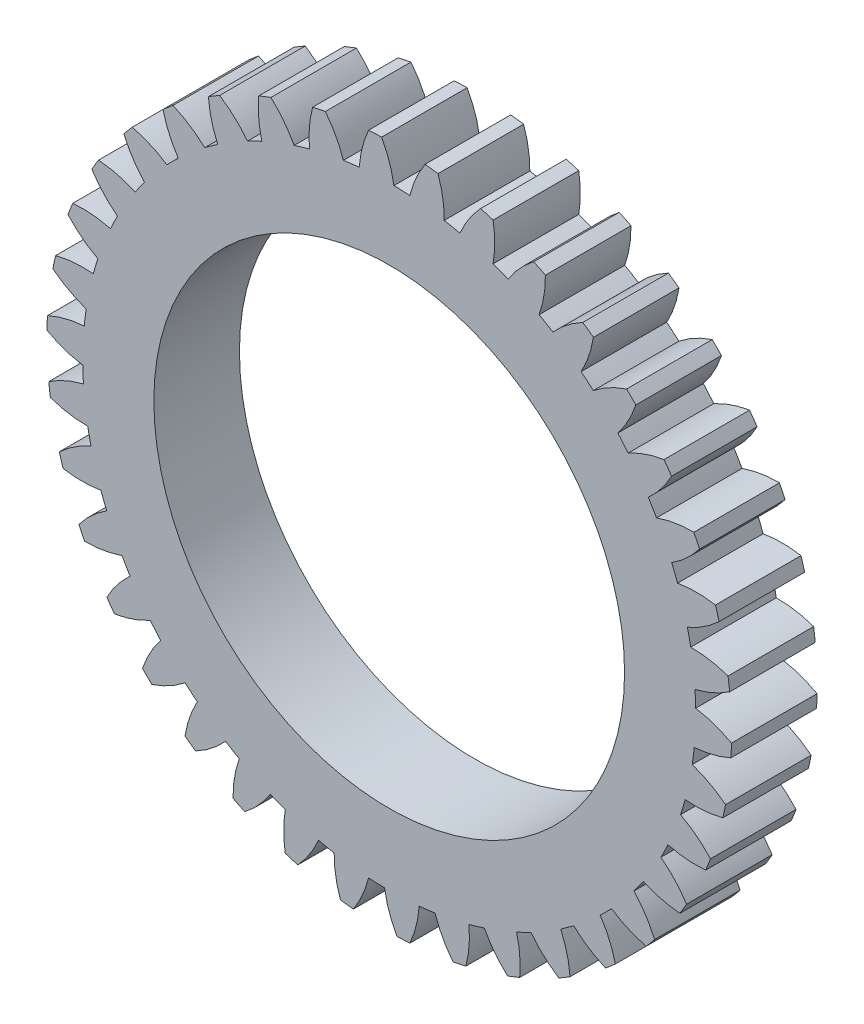
from build123d import *

# Parameters (mm, degrees)
BODY_DEPTH         = 10
TOOTHEXTRUDE_DEPTH = 10
CIRPATTERN1_COUNT  = 38
SKETCH5_R          = 27.5
CUT_EXTRUDE1_DEPTH = 58.431802193


with BuildPart() as part:
    # Gear → body (new body)
    with BuildSketch(Plane.XY):
        with BuildLine():
            ThreePointArc((-3.501112539, 35.635289159), (-24.049612849, -26.528244274), (35.806865577, 0))
            ThreePointArc((35.806865577, 0), (25.511733112, 25.125347681), (0.54641561, 35.802696162))
            ThreePointArc((0.54641561, 35.802696162), (-1.479717798, 35.776277863), (-3.501112539, 35.635289159))
        make_face()
    extrude(amount=BODY_DEPTH)

    # Gear<3> → ToothExtrude (add)
    with BuildSketch(Plane.XY):
        with BuildLine():
            ThreePointArc((-3.501112539, 35.635289159), (-1.479717798, 35.776277863), (0.54641561, 35.802696162))
            add(Edge.make_bspline(
                [(0.54641561, 35.802696162), (0.533338051, 35.886308917), (0.28734018, 37.365137899), (-0.205755547, 38.755971582), (-0.891099015, 39.99007305)],
                knots=[-0.056473224, -0.056473224, -0.056473224, -0.056473224, 0, 0.945697652, 0.945697652, 0.945697652, 0.945697652], degree=3))
            ThreePointArc((-0.891099015, 39.99007305), (-1.65299897, 39.965830335), (-2.414298597, 39.927073049))
            add(Edge.make_bspline(
                [(-3.501112539, 35.635289159), (-3.494984333, 35.719696271), (-3.371947399, 37.213788645), (-2.995389979, 38.640591448), (-2.414298597, 39.927073049)],
                knots=[-0.056473224, -0.056473224, -0.056473224, -0.056473224, 0, 0.945697652, 0.945697652, 0.945697652, 0.945697652], degree=3))
        make_face()
    toothextrude = extrude(amount=TOOTHEXTRUDE_DEPTH)

    # CirPattern1: ToothExtrude ×38 about axis
    cirpattern1_axis = Axis((0, 0, 10), (0, 0, -1))
    for i in range(1, CIRPATTERN1_COUNT):
        add(toothextrude.rotate(cirpattern1_axis, i * 360 / CIRPATTERN1_COUNT))

    # Sketch5 → Cut-Extrude1 (cut, through all)
    with BuildSketch(Plane.XY.offset(10)):
        Circle(SKETCH5_R)
    extrude(amount=-CUT_EXTRUDE1_DEPTH, mode=Mode.SUBTRACT)


solid = part.part
